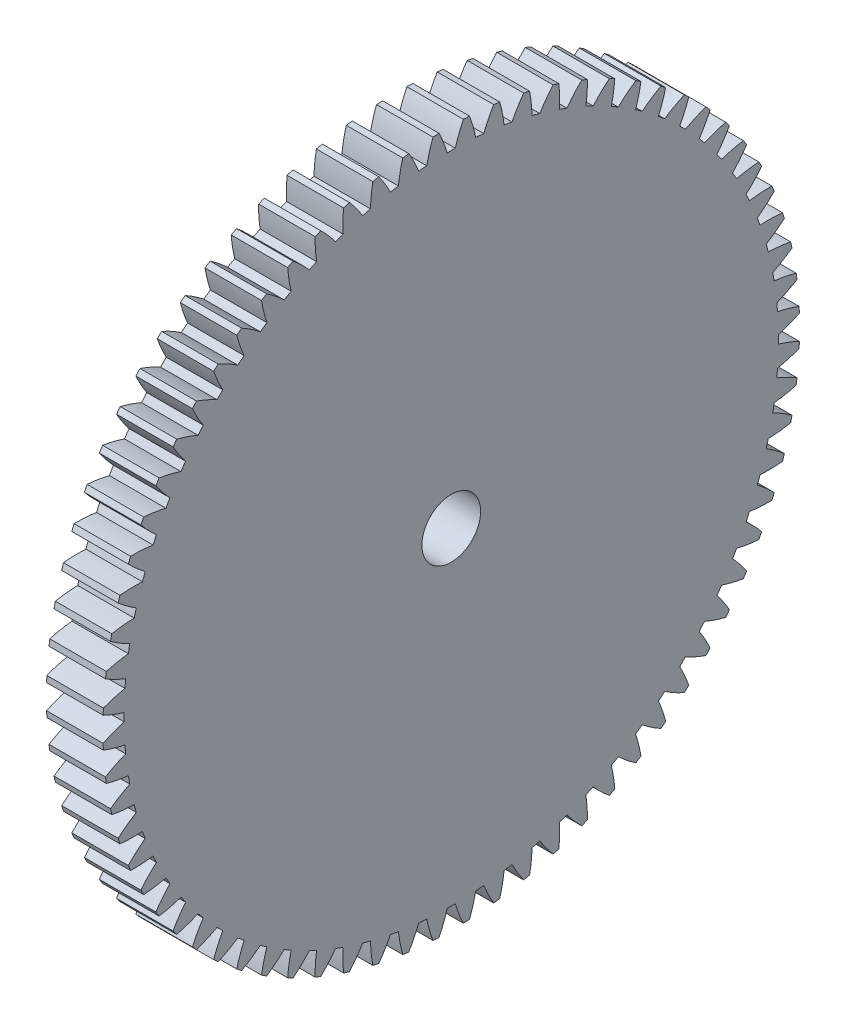
from build123d import *

# Parameters (mm, degrees)
SKETCH1_W          = 6.35
SKETCH1_H          = 39.158333333
CUT_EXTRUDE1_DEPTH = 56.741121615
SKETCH5_R          = 3.302
CUT_EXTRUDE3_DEPTH = 56.70763123


with BuildPart() as part:
    # Sketch1 → Revolve1 (revolve)
    with BuildSketch(Plane.XY, mode=Mode.PRIVATE) as revolve1_sk:
        with Locations((3.175, 19.579166667)):
            Rectangle(SKETCH1_W, SKETCH1_H)
    revolve(revolve1_sk.sketch.rotate(Axis((-10, 0, 0), (1, 0, 0)), 90), axis=Axis((-10, 0, 0), (1, 0, 0)))

    # Sketch2 → Cut-Extrude1 (cut, through all)
    with BuildSketch(Plane.ZY):
        with BuildLine():
            ThreePointArc((0.453579929, 36.776403004), (0, 36.7792), (-0.453579929, 36.776403004))
            ThreePointArc((-0.453579929, 36.776403004), (-0.86587275, 37.987365832), (-1.378270139, 39.159485816))
            ThreePointArc((-1.378270139, 39.159485816), (0, 39.183733333), (1.378270139, 39.159485816))
            ThreePointArc((1.378270139, 39.159485816), (0.86587275, 37.987365832), (0.453579929, 36.776403004))
        make_face()
        with BuildLine():
            ThreePointArc((2.753420799, 36.675989783), (2.448239242, 37.918278219), (2.039948667, 39.130596307))
            ThreePointArc((2.039948667, 39.130596307), (3.415087382, 39.034627398), (4.785999477, 38.890347992))
            ThreePointArc((4.785999477, 38.890347992), (4.173394926, 37.767346654), (3.65712864, 36.596925592))
            ThreePointArc((3.65712864, 36.596925592), (3.205518494, 36.63924404), (2.753420799, 36.675989783))
        make_face()
        with BuildLine():
            ThreePointArc((5.939466332, 36.296450134), (5.743718654, 37.560609613), (5.442642232, 38.803899333))
            ThreePointArc((5.442642232, 38.803899333), (6.804183888, 38.588444379), (8.157304469, 38.325231137))
            ThreePointArc((8.157304469, 38.325231137), (7.449155048, 37.259895163), (6.832844394, 36.138923478))
            ThreePointArc((6.832844394, 36.138923478), (6.386641056, 36.22044131), (5.939466332, 36.296450134))
        make_face()
        with BuildLine():
            ThreePointArc((9.08030894, 35.640672583), (8.9954849, 36.917082088), (8.803914003, 38.181881255))
            ThreePointArc((8.803914003, 38.181881255), (10.141496445, 37.848579997), (11.466527448, 37.468436132))
            ThreePointArc((11.466527448, 37.468436132), (10.668222602, 36.468873372), (9.956558076, 35.405882335))
            ThreePointArc((9.956558076, 35.405882335), (9.519157424, 35.52597915), (9.08030894, 35.640672583))
        make_face()
        with BuildLine():
            ThreePointArc((12.152044914, 34.713647994), (12.178790073, 35.992593277), (12.098182672, 37.269276005))
            ThreePointArc((12.098182672, 37.269276005), (13.401626091, 36.820665068), (14.68848323, 36.326483704))
            ThreePointArc((14.68848323, 36.326483704), (13.80609854, 35.400301434), (13.004496339, 34.403381049))
            ThreePointArc((13.004496339, 34.403381049), (12.579227255, 34.561142838), (12.152044914, 34.713647994))
        make_face()
        with BuildLine():
            ThreePointArc((15.131296489, 33.522431583), (15.269407301, 34.794179099), (15.300376867, 36.073029062))
            ThreePointArc((15.300376867, 36.073029062), (16.55976127, 35.512522645), (17.798650786, 34.908064801))
            ThreePointArc((17.798650786, 34.908064801), (16.838901731, 34.062311826), (15.953462532, 33.13904926))
            ThreePointArc((15.953462532, 33.13904926), (15.543561572, 33.333275361), (15.131296489, 33.522431583))
        make_face()
        with BuildLine():
            ThreePointArc((17.99538976, 32.076089226), (18.243815118, 33.330960208), (18.386125954, 34.602244585))
            ThreePointArc((18.386125954, 34.602244585), (19.591866667, 33.934108482), (20.773359862, 33.223974446))
            ThreePointArc((20.773359862, 33.223974446), (19.743550714, 32.465087459), (18.781013243, 31.622509296))
            ThreePointArc((18.781013243, 31.622509296), (18.3896, 31.851721531), (17.99538976, 32.076089226))
        make_face()
        with BuildLine():
            ThreePointArc((20.72252725, 30.385628461), (21.079376487, 31.614072584), (21.331945522, 32.868116134))
            ThreePointArc((21.331945522, 32.868116134), (22.474866128, 32.097435263), (23.589971126, 31.287029585))
            ThreePointArc((23.589971126, 31.287029585), (22.497939353, 30.620784172), (21.465629103, 29.865302943))
            ThreePointArc((21.465629103, 29.865302943), (21.095682468, 30.127756867), (20.72252725, 30.385628461))
        make_face()
        with BuildLine():
            ThreePointArc((23.291953795, 28.463914717), (23.754511073, 29.656582779), (24.115416103, 30.883841473))
            ThreePointArc((24.115416103, 30.883841473), (25.186818288, 30.016481181), (26.227048465, 29.111971536))
            ThreePointArc((26.227048465, 29.111971536), (25.08110509, 28.543438229), (23.986878564, 27.8808036))
            ThreePointArc((23.986878564, 27.8808036), (23.641214054, 28.174501782), (23.291953795, 28.463914717))
        make_face()
        with BuildLine():
            ThreePointArc((25.684114508, 26.325573395), (26.248859486, 27.473388472), (26.715353807, 28.66452213))
            ThreePointArc((26.715353807, 28.66452213), (27.707083552, 27.707083552), (28.66452213, 26.715353807))
            ThreePointArc((28.66452213, 26.715353807), (27.473388472, 26.248859486), (26.325573395, 25.684114508))
            ThreePointArc((26.325573395, 25.684114508), (26.006821727, 26.006821727), (25.684114508, 26.325573395))
        make_face()
        with BuildLine():
            ThreePointArc((27.8808036, 23.986878564), (28.543438229, 25.08110509), (29.111971536, 26.227048465))
            ThreePointArc((29.111971536, 26.227048465), (30.016481181, 25.186818288), (30.883841473, 24.115416103))
            ThreePointArc((30.883841473, 24.115416103), (29.656582779, 23.754511073), (28.463914717, 23.291953795))
            ThreePointArc((28.463914717, 23.291953795), (28.174501782, 23.641214054), (27.8808036, 23.986878564))
        make_face()
        with BuildLine():
            ThreePointArc((29.865302943, 21.465629103), (30.620784172, 22.497939353), (31.287029585, 23.589971126))
            ThreePointArc((31.287029585, 23.589971126), (32.097435263, 22.474866128), (32.868116134, 21.331945522))
            ThreePointArc((32.868116134, 21.331945522), (31.614072584, 21.079376487), (30.385628461, 20.72252725))
            ThreePointArc((30.385628461, 20.72252725), (30.127756867, 21.095682468), (29.865302943, 21.465629103))
        make_face()
        with BuildLine():
            ThreePointArc((31.622509296, 18.781013243), (32.465087459, 19.743550714), (33.223974446, 20.773359862))
            ThreePointArc((33.223974446, 20.773359862), (33.934108482, 19.591866667), (34.602244585, 18.386125954))
            ThreePointArc((34.602244585, 18.386125954), (33.330960208, 18.243815118), (32.076089226, 17.99538976))
            ThreePointArc((32.076089226, 17.99538976), (31.851721531, 18.3896), (31.622509296, 18.781013243))
        make_face()
        with BuildLine():
            ThreePointArc((33.13904926, 15.953462532), (34.062311826, 16.838901731), (34.908064801, 17.798650786))
            ThreePointArc((34.908064801, 17.798650786), (35.512522645, 16.55976127), (36.073029062, 15.300376867))
            ThreePointArc((36.073029062, 15.300376867), (34.794179099, 15.269407301), (33.522431583, 15.131296489))
            ThreePointArc((33.522431583, 15.131296489), (33.333275361, 15.543561572), (33.13904926, 15.953462532))
        make_face()
        with BuildLine():
            ThreePointArc((34.403381049, 13.004496339), (35.400301434, 13.80609854), (36.326483704, 14.68848323))
            ThreePointArc((36.326483704, 14.68848323), (36.820665068, 13.401626091), (37.269276005, 12.098182672))
            ThreePointArc((37.269276005, 12.098182672), (35.992593277, 12.178790073), (34.713647994, 12.152044914))
            ThreePointArc((34.713647994, 12.152044914), (34.561142838, 12.579227255), (34.403381049, 13.004496339))
        make_face()
        with BuildLine():
            ThreePointArc((35.405882335, 9.956558076), (36.468873372, 10.668222602), (37.468436132, 11.466527448))
            ThreePointArc((37.468436132, 11.466527448), (37.848579997, 10.141496445), (38.181881255, 8.803914003))
            ThreePointArc((38.181881255, 8.803914003), (36.917082088, 8.9954849), (35.640672583, 9.08030894))
            ThreePointArc((35.640672583, 9.08030894), (35.52597915, 9.519157424), (35.405882335, 9.956558076))
        make_face()
        with BuildLine():
            ThreePointArc((36.138923478, 6.832844394), (37.259895163, 7.449155048), (38.325231137, 8.157304469))
            ThreePointArc((38.325231137, 8.157304469), (38.588444379, 6.804183888), (38.803899333, 5.442642232))
            ThreePointArc((38.803899333, 5.442642232), (37.560609613, 5.743718654), (36.296450134, 5.939466332))
            ThreePointArc((36.296450134, 5.939466332), (36.22044131, 6.386641056), (36.138923478, 6.832844394))
        make_face()
        with BuildLine():
            ThreePointArc((36.596925592, 3.65712864), (37.767346654, 4.173394926), (38.890347992, 4.785999477))
            ThreePointArc((38.890347992, 4.785999477), (39.034627398, 3.415087382), (39.130596307, 2.039948667))
            ThreePointArc((39.130596307, 2.039948667), (37.918278219, 2.448239242), (36.675989783, 2.753420799))
            ThreePointArc((36.675989783, 2.753420799), (36.63924404, 3.205518494), (36.596925592, 3.65712864))
        make_face()
        with BuildLine():
            ThreePointArc((36.776403004, 0.453579929), (37.987365832, 0.86587275), (39.159485816, 1.378270139))
            ThreePointArc((39.159485816, 1.378270139), (39.183733333, 0), (39.159485816, -1.378270139))
            ThreePointArc((39.159485816, -1.378270139), (37.987365832, -0.86587275), (36.776403004, -0.453579929))
            ThreePointArc((36.776403004, -0.453579929), (36.7792, 0), (36.776403004, 0.453579929))
        make_face()
        with BuildLine():
            ThreePointArc((36.675989783, -2.753420799), (37.918278219, -2.448239242), (39.130596307, -2.039948667))
            ThreePointArc((39.130596307, -2.039948667), (39.034627398, -3.415087382), (38.890347992, -4.785999477))
            ThreePointArc((38.890347992, -4.785999477), (37.767346654, -4.173394926), (36.596925592, -3.65712864))
            ThreePointArc((36.596925592, -3.65712864), (36.63924404, -3.205518494), (36.675989783, -2.753420799))
        make_face()
        with BuildLine():
            ThreePointArc((36.296450134, -5.939466332), (37.560609613, -5.743718654), (38.803899333, -5.442642232))
            ThreePointArc((38.803899333, -5.442642232), (38.588444379, -6.804183888), (38.325231137, -8.157304469))
            ThreePointArc((38.325231137, -8.157304469), (37.259895163, -7.449155048), (36.138923478, -6.832844394))
            ThreePointArc((36.138923478, -6.832844394), (36.22044131, -6.386641056), (36.296450134, -5.939466332))
        make_face()
        with BuildLine():
            ThreePointArc((35.640672583, -9.08030894), (36.917082088, -8.9954849), (38.181881255, -8.803914003))
            ThreePointArc((38.181881255, -8.803914003), (37.848579997, -10.141496445), (37.468436132, -11.466527448))
            ThreePointArc((37.468436132, -11.466527448), (36.468873372, -10.668222602), (35.405882335, -9.956558076))
            ThreePointArc((35.405882335, -9.956558076), (35.52597915, -9.519157424), (35.640672583, -9.08030894))
        make_face()
        with BuildLine():
            ThreePointArc((34.713647994, -12.152044914), (35.992593277, -12.178790073), (37.269276005, -12.098182672))
            ThreePointArc((37.269276005, -12.098182672), (36.820665068, -13.401626091), (36.326483704, -14.68848323))
            ThreePointArc((36.326483704, -14.68848323), (35.400301434, -13.80609854), (34.403381049, -13.004496339))
            ThreePointArc((34.403381049, -13.004496339), (34.561142838, -12.579227255), (34.713647994, -12.152044914))
        make_face()
        with BuildLine():
            ThreePointArc((33.522431583, -15.131296489), (34.794179099, -15.269407301), (36.073029062, -15.300376867))
            ThreePointArc((36.073029062, -15.300376867), (35.512522645, -16.55976127), (34.908064801, -17.798650786))
            ThreePointArc((34.908064801, -17.798650786), (34.062311826, -16.838901731), (33.13904926, -15.953462532))
            ThreePointArc((33.13904926, -15.953462532), (33.333275361, -15.543561572), (33.522431583, -15.131296489))
        make_face()
        with BuildLine():
            ThreePointArc((32.076089226, -17.99538976), (33.330960208, -18.243815118), (34.602244585, -18.386125954))
            ThreePointArc((34.602244585, -18.386125954), (33.934108482, -19.591866667), (33.223974446, -20.773359862))
            ThreePointArc((33.223974446, -20.773359862), (32.465087459, -19.743550714), (31.622509296, -18.781013243))
            ThreePointArc((31.622509296, -18.781013243), (31.851721531, -18.3896), (32.076089226, -17.99538976))
        make_face()
        with BuildLine():
            ThreePointArc((30.385628461, -20.72252725), (31.614072584, -21.079376487), (32.868116134, -21.331945522))
            ThreePointArc((32.868116134, -21.331945522), (32.097435263, -22.474866128), (31.287029585, -23.589971126))
            ThreePointArc((31.287029585, -23.589971126), (30.620784172, -22.497939353), (29.865302943, -21.465629103))
            ThreePointArc((29.865302943, -21.465629103), (30.127756867, -21.095682468), (30.385628461, -20.72252725))
        make_face()
        with BuildLine():
            ThreePointArc((28.463914717, -23.291953795), (29.656582779, -23.754511073), (30.883841473, -24.115416103))
            ThreePointArc((30.883841473, -24.115416103), (30.016481181, -25.186818288), (29.111971536, -26.227048465))
            ThreePointArc((29.111971536, -26.227048465), (28.543438229, -25.08110509), (27.8808036, -23.986878564))
            ThreePointArc((27.8808036, -23.986878564), (28.174501782, -23.641214054), (28.463914717, -23.291953795))
        make_face()
        with BuildLine():
            ThreePointArc((26.325573395, -25.684114508), (27.473388472, -26.248859486), (28.66452213, -26.715353807))
            ThreePointArc((28.66452213, -26.715353807), (27.707083552, -27.707083552), (26.715353807, -28.66452213))
            ThreePointArc((26.715353807, -28.66452213), (26.248859486, -27.473388472), (25.684114508, -26.325573395))
            ThreePointArc((25.684114508, -26.325573395), (26.006821727, -26.006821727), (26.325573395, -25.684114508))
        make_face()
        with BuildLine():
            ThreePointArc((23.986878564, -27.8808036), (25.08110509, -28.543438229), (26.227048465, -29.111971536))
            ThreePointArc((26.227048465, -29.111971536), (25.186818288, -30.016481181), (24.115416103, -30.883841473))
            ThreePointArc((24.115416103, -30.883841473), (23.754511073, -29.656582779), (23.291953795, -28.463914717))
            ThreePointArc((23.291953795, -28.463914717), (23.641214054, -28.174501782), (23.986878564, -27.8808036))
        make_face()
        with BuildLine():
            ThreePointArc((21.465629103, -29.865302943), (22.497939353, -30.620784172), (23.589971126, -31.287029585))
            ThreePointArc((23.589971126, -31.287029585), (22.474866128, -32.097435263), (21.331945522, -32.868116134))
            ThreePointArc((21.331945522, -32.868116134), (21.079376487, -31.614072584), (20.72252725, -30.385628461))
            ThreePointArc((20.72252725, -30.385628461), (21.095682468, -30.127756867), (21.465629103, -29.865302943))
        make_face()
        with BuildLine():
            ThreePointArc((18.781013243, -31.622509296), (19.743550714, -32.465087459), (20.773359862, -33.223974446))
            ThreePointArc((20.773359862, -33.223974446), (19.591866667, -33.934108482), (18.386125954, -34.602244585))
            ThreePointArc((18.386125954, -34.602244585), (18.243815118, -33.330960208), (17.99538976, -32.076089226))
            ThreePointArc((17.99538976, -32.076089226), (18.3896, -31.851721531), (18.781013243, -31.622509296))
        make_face()
        with BuildLine():
            ThreePointArc((15.953462532, -33.13904926), (16.838901731, -34.062311826), (17.798650786, -34.908064801))
            ThreePointArc((17.798650786, -34.908064801), (16.55976127, -35.512522645), (15.300376867, -36.073029062))
            ThreePointArc((15.300376867, -36.073029062), (15.269407301, -34.794179099), (15.131296489, -33.522431583))
            ThreePointArc((15.131296489, -33.522431583), (15.543561572, -33.333275361), (15.953462532, -33.13904926))
        make_face()
        with BuildLine():
            ThreePointArc((13.004496339, -34.403381049), (13.80609854, -35.400301434), (14.68848323, -36.326483704))
            ThreePointArc((14.68848323, -36.326483704), (13.401626091, -36.820665068), (12.098182672, -37.269276005))
            ThreePointArc((12.098182672, -37.269276005), (12.178790073, -35.992593277), (12.152044914, -34.713647994))
            ThreePointArc((12.152044914, -34.713647994), (12.579227255, -34.561142838), (13.004496339, -34.403381049))
        make_face()
        with BuildLine():
            ThreePointArc((9.956558076, -35.405882335), (10.668222602, -36.468873372), (11.466527448, -37.468436132))
            ThreePointArc((11.466527448, -37.468436132), (10.141496445, -37.848579997), (8.803914003, -38.181881255))
            ThreePointArc((8.803914003, -38.181881255), (8.9954849, -36.917082088), (9.08030894, -35.640672583))
            ThreePointArc((9.08030894, -35.640672583), (9.519157424, -35.52597915), (9.956558076, -35.405882335))
        make_face()
        with BuildLine():
            ThreePointArc((6.832844394, -36.138923478), (7.449155048, -37.259895163), (8.157304469, -38.325231137))
            ThreePointArc((8.157304469, -38.325231137), (6.804183888, -38.588444379), (5.442642232, -38.803899333))
            ThreePointArc((5.442642232, -38.803899333), (5.743718654, -37.560609613), (5.939466332, -36.296450134))
            ThreePointArc((5.939466332, -36.296450134), (6.386641056, -36.22044131), (6.832844394, -36.138923478))
        make_face()
        with BuildLine():
            ThreePointArc((3.65712864, -36.596925592), (4.173394926, -37.767346654), (4.785999477, -38.890347992))
            ThreePointArc((4.785999477, -38.890347992), (3.415087382, -39.034627398), (2.039948667, -39.130596307))
            ThreePointArc((2.039948667, -39.130596307), (2.448239242, -37.918278219), (2.753420799, -36.675989783))
            ThreePointArc((2.753420799, -36.675989783), (3.205518494, -36.63924404), (3.65712864, -36.596925592))
        make_face()
        with BuildLine():
            ThreePointArc((0.453579929, -36.776403004), (0.86587275, -37.987365832), (1.378270139, -39.159485816))
            ThreePointArc((1.378270139, -39.159485816), (0, -39.183733333), (-1.378270139, -39.159485816))
            ThreePointArc((-1.378270139, -39.159485816), (-0.86587275, -37.987365832), (-0.453579929, -36.776403004))
            ThreePointArc((-0.453579929, -36.776403004), (0, -36.7792), (0.453579929, -36.776403004))
        make_face()
        with BuildLine():
            ThreePointArc((-2.753420799, -36.675989783), (-2.448239242, -37.918278219), (-2.039948667, -39.130596307))
            ThreePointArc((-2.039948667, -39.130596307), (-3.415087382, -39.034627398), (-4.785999477, -38.890347992))
            ThreePointArc((-4.785999477, -38.890347992), (-4.173394926, -37.767346654), (-3.65712864, -36.596925592))
            ThreePointArc((-3.65712864, -36.596925592), (-3.205518494, -36.63924404), (-2.753420799, -36.675989783))
        make_face()
        with BuildLine():
            ThreePointArc((-5.939466332, -36.296450134), (-5.743718654, -37.560609613), (-5.442642232, -38.803899333))
            ThreePointArc((-5.442642232, -38.803899333), (-6.804183888, -38.588444379), (-8.157304469, -38.325231137))
            ThreePointArc((-8.157304469, -38.325231137), (-7.449155048, -37.259895163), (-6.832844394, -36.138923478))
            ThreePointArc((-6.832844394, -36.138923478), (-6.386641056, -36.22044131), (-5.939466332, -36.296450134))
        make_face()
        with BuildLine():
            ThreePointArc((-9.08030894, -35.640672583), (-8.9954849, -36.917082088), (-8.803914003, -38.181881255))
            ThreePointArc((-8.803914003, -38.181881255), (-10.141496445, -37.848579997), (-11.466527448, -37.468436132))
            ThreePointArc((-11.466527448, -37.468436132), (-10.668222602, -36.468873372), (-9.956558076, -35.405882335))
            ThreePointArc((-9.956558076, -35.405882335), (-9.519157424, -35.52597915), (-9.08030894, -35.640672583))
        make_face()
        with BuildLine():
            ThreePointArc((-12.152044914, -34.713647994), (-12.178790073, -35.992593277), (-12.098182672, -37.269276005))
            ThreePointArc((-12.098182672, -37.269276005), (-13.401626091, -36.820665068), (-14.68848323, -36.326483704))
            ThreePointArc((-14.68848323, -36.326483704), (-13.80609854, -35.400301434), (-13.004496339, -34.403381049))
            ThreePointArc((-13.004496339, -34.403381049), (-12.579227255, -34.561142838), (-12.152044914, -34.713647994))
        make_face()
        with BuildLine():
            ThreePointArc((-15.131296489, -33.522431583), (-15.269407301, -34.794179099), (-15.300376867, -36.073029062))
            ThreePointArc((-15.300376867, -36.073029062), (-16.55976127, -35.512522645), (-17.798650786, -34.908064801))
            ThreePointArc((-17.798650786, -34.908064801), (-16.838901731, -34.062311826), (-15.953462532, -33.13904926))
            ThreePointArc((-15.953462532, -33.13904926), (-15.543561572, -33.333275361), (-15.131296489, -33.522431583))
        make_face()
        with BuildLine():
            ThreePointArc((-17.99538976, -32.076089226), (-18.243815118, -33.330960208), (-18.386125954, -34.602244585))
            ThreePointArc((-18.386125954, -34.602244585), (-19.591866667, -33.934108482), (-20.773359862, -33.223974446))
            ThreePointArc((-20.773359862, -33.223974446), (-19.743550714, -32.465087459), (-18.781013243, -31.622509296))
            ThreePointArc((-18.781013243, -31.622509296), (-18.3896, -31.851721531), (-17.99538976, -32.076089226))
        make_face()
        with BuildLine():
            ThreePointArc((-20.72252725, -30.385628461), (-21.079376487, -31.614072584), (-21.331945522, -32.868116134))
            ThreePointArc((-21.331945522, -32.868116134), (-22.474866128, -32.097435263), (-23.589971126, -31.287029585))
            ThreePointArc((-23.589971126, -31.287029585), (-22.497939353, -30.620784172), (-21.465629103, -29.865302943))
            ThreePointArc((-21.465629103, -29.865302943), (-21.095682468, -30.127756867), (-20.72252725, -30.385628461))
        make_face()
        with BuildLine():
            ThreePointArc((-23.291953795, -28.463914717), (-23.754511073, -29.656582779), (-24.115416103, -30.883841473))
            ThreePointArc((-24.115416103, -30.883841473), (-25.186818288, -30.016481181), (-26.227048465, -29.111971536))
            ThreePointArc((-26.227048465, -29.111971536), (-25.08110509, -28.543438229), (-23.986878564, -27.8808036))
            ThreePointArc((-23.986878564, -27.8808036), (-23.641214054, -28.174501782), (-23.291953795, -28.463914717))
        make_face()
        with BuildLine():
            ThreePointArc((-25.684114508, -26.325573395), (-26.248859486, -27.473388472), (-26.715353807, -28.66452213))
            ThreePointArc((-26.715353807, -28.66452213), (-27.707083552, -27.707083552), (-28.66452213, -26.715353807))
            ThreePointArc((-28.66452213, -26.715353807), (-27.473388472, -26.248859486), (-26.325573395, -25.684114508))
            ThreePointArc((-26.325573395, -25.684114508), (-26.006821727, -26.006821727), (-25.684114508, -26.325573395))
        make_face()
        with BuildLine():
            ThreePointArc((-27.8808036, -23.986878564), (-28.543438229, -25.08110509), (-29.111971536, -26.227048465))
            ThreePointArc((-29.111971536, -26.227048465), (-30.016481181, -25.186818288), (-30.883841473, -24.115416103))
            ThreePointArc((-30.883841473, -24.115416103), (-29.656582779, -23.754511073), (-28.463914717, -23.291953795))
            ThreePointArc((-28.463914717, -23.291953795), (-28.174501782, -23.641214054), (-27.8808036, -23.986878564))
        make_face()
        with BuildLine():
            ThreePointArc((-29.865302943, -21.465629103), (-30.620784172, -22.497939353), (-31.287029585, -23.589971126))
            ThreePointArc((-31.287029585, -23.589971126), (-32.097435263, -22.474866128), (-32.868116134, -21.331945522))
            ThreePointArc((-32.868116134, -21.331945522), (-31.614072584, -21.079376487), (-30.385628461, -20.72252725))
            ThreePointArc((-30.385628461, -20.72252725), (-30.127756867, -21.095682468), (-29.865302943, -21.465629103))
        make_face()
        with BuildLine():
            ThreePointArc((-31.622509296, -18.781013243), (-32.465087459, -19.743550714), (-33.223974446, -20.773359862))
            ThreePointArc((-33.223974446, -20.773359862), (-33.934108482, -19.591866667), (-34.602244585, -18.386125954))
            ThreePointArc((-34.602244585, -18.386125954), (-33.330960208, -18.243815118), (-32.076089226, -17.99538976))
            ThreePointArc((-32.076089226, -17.99538976), (-31.851721531, -18.3896), (-31.622509296, -18.781013243))
        make_face()
        with BuildLine():
            ThreePointArc((-33.13904926, -15.953462532), (-34.062311826, -16.838901731), (-34.908064801, -17.798650786))
            ThreePointArc((-34.908064801, -17.798650786), (-35.512522645, -16.55976127), (-36.073029062, -15.300376867))
            ThreePointArc((-36.073029062, -15.300376867), (-34.794179099, -15.269407301), (-33.522431583, -15.131296489))
            ThreePointArc((-33.522431583, -15.131296489), (-33.333275361, -15.543561572), (-33.13904926, -15.953462532))
        make_face()
        with BuildLine():
            ThreePointArc((-34.403381049, -13.004496339), (-35.400301434, -13.80609854), (-36.326483704, -14.68848323))
            ThreePointArc((-36.326483704, -14.68848323), (-36.820665068, -13.401626091), (-37.269276005, -12.098182672))
            ThreePointArc((-37.269276005, -12.098182672), (-35.992593277, -12.178790073), (-34.713647994, -12.152044914))
            ThreePointArc((-34.713647994, -12.152044914), (-34.561142838, -12.579227255), (-34.403381049, -13.004496339))
        make_face()
        with BuildLine():
            ThreePointArc((-35.405882335, -9.956558076), (-36.468873372, -10.668222602), (-37.468436132, -11.466527448))
            ThreePointArc((-37.468436132, -11.466527448), (-37.848579997, -10.141496445), (-38.181881255, -8.803914003))
            ThreePointArc((-38.181881255, -8.803914003), (-36.917082088, -8.9954849), (-35.640672583, -9.08030894))
            ThreePointArc((-35.640672583, -9.08030894), (-35.52597915, -9.519157424), (-35.405882335, -9.956558076))
        make_face()
        with BuildLine():
            ThreePointArc((-36.138923478, -6.832844394), (-37.259895163, -7.449155048), (-38.325231137, -8.157304469))
            ThreePointArc((-38.325231137, -8.157304469), (-38.588444379, -6.804183888), (-38.803899333, -5.442642232))
            ThreePointArc((-38.803899333, -5.442642232), (-37.560609613, -5.743718654), (-36.296450134, -5.939466332))
            ThreePointArc((-36.296450134, -5.939466332), (-36.22044131, -6.386641056), (-36.138923478, -6.832844394))
        make_face()
        with BuildLine():
            ThreePointArc((-36.596925592, -3.65712864), (-37.767346654, -4.173394926), (-38.890347992, -4.785999477))
            ThreePointArc((-38.890347992, -4.785999477), (-39.034627398, -3.415087382), (-39.130596307, -2.039948667))
            ThreePointArc((-39.130596307, -2.039948667), (-37.918278219, -2.448239242), (-36.675989783, -2.753420799))
            ThreePointArc((-36.675989783, -2.753420799), (-36.63924404, -3.205518494), (-36.596925592, -3.65712864))
        make_face()
        with BuildLine():
            ThreePointArc((-36.776403004, -0.453579929), (-37.987365832, -0.86587275), (-39.159485816, -1.378270139))
            ThreePointArc((-39.159485816, -1.378270139), (-39.183733333, 0), (-39.159485816, 1.378270139))
            ThreePointArc((-39.159485816, 1.378270139), (-37.987365832, 0.86587275), (-36.776403004, 0.453579929))
            ThreePointArc((-36.776403004, 0.453579929), (-36.7792, 0), (-36.776403004, -0.453579929))
        make_face()
        with BuildLine():
            ThreePointArc((-36.675989783, 2.753420799), (-37.918278219, 2.448239242), (-39.130596307, 2.039948667))
            ThreePointArc((-39.130596307, 2.039948667), (-39.034627398, 3.415087382), (-38.890347992, 4.785999477))
            ThreePointArc((-38.890347992, 4.785999477), (-37.767346654, 4.173394926), (-36.596925592, 3.65712864))
            ThreePointArc((-36.596925592, 3.65712864), (-36.63924404, 3.205518494), (-36.675989783, 2.753420799))
        make_face()
        with BuildLine():
            ThreePointArc((-36.296450134, 5.939466332), (-37.560609613, 5.743718654), (-38.803899333, 5.442642232))
            ThreePointArc((-38.803899333, 5.442642232), (-38.588444379, 6.804183888), (-38.325231137, 8.157304469))
            ThreePointArc((-38.325231137, 8.157304469), (-37.259895163, 7.449155048), (-36.138923478, 6.832844394))
            ThreePointArc((-36.138923478, 6.832844394), (-36.22044131, 6.386641056), (-36.296450134, 5.939466332))
        make_face()
        with BuildLine():
            ThreePointArc((-35.640672583, 9.08030894), (-36.917082088, 8.9954849), (-38.181881255, 8.803914003))
            ThreePointArc((-38.181881255, 8.803914003), (-37.848579997, 10.141496445), (-37.468436132, 11.466527448))
            ThreePointArc((-37.468436132, 11.466527448), (-36.468873372, 10.668222602), (-35.405882335, 9.956558076))
            ThreePointArc((-35.405882335, 9.956558076), (-35.52597915, 9.519157424), (-35.640672583, 9.08030894))
        make_face()
        with BuildLine():
            ThreePointArc((-34.713647994, 12.152044914), (-35.992593277, 12.178790073), (-37.269276005, 12.098182672))
            ThreePointArc((-37.269276005, 12.098182672), (-36.820665068, 13.401626091), (-36.326483704, 14.68848323))
            ThreePointArc((-36.326483704, 14.68848323), (-35.400301434, 13.80609854), (-34.403381049, 13.004496339))
            ThreePointArc((-34.403381049, 13.004496339), (-34.561142838, 12.579227255), (-34.713647994, 12.152044914))
        make_face()
        with BuildLine():
            ThreePointArc((-33.522431583, 15.131296489), (-34.794179099, 15.269407301), (-36.073029062, 15.300376867))
            ThreePointArc((-36.073029062, 15.300376867), (-35.512522645, 16.55976127), (-34.908064801, 17.798650786))
            ThreePointArc((-34.908064801, 17.798650786), (-34.062311826, 16.838901731), (-33.13904926, 15.953462532))
            ThreePointArc((-33.13904926, 15.953462532), (-33.333275361, 15.543561572), (-33.522431583, 15.131296489))
        make_face()
        with BuildLine():
            ThreePointArc((-32.076089226, 17.99538976), (-33.330960208, 18.243815118), (-34.602244585, 18.386125954))
            ThreePointArc((-34.602244585, 18.386125954), (-33.934108482, 19.591866667), (-33.223974446, 20.773359862))
            ThreePointArc((-33.223974446, 20.773359862), (-32.465087459, 19.743550714), (-31.622509296, 18.781013243))
            ThreePointArc((-31.622509296, 18.781013243), (-31.851721531, 18.3896), (-32.076089226, 17.99538976))
        make_face()
        with BuildLine():
            ThreePointArc((-30.385628461, 20.72252725), (-31.614072584, 21.079376487), (-32.868116134, 21.331945522))
            ThreePointArc((-32.868116134, 21.331945522), (-32.097435263, 22.474866128), (-31.287029585, 23.589971126))
            ThreePointArc((-31.287029585, 23.589971126), (-30.620784172, 22.497939353), (-29.865302943, 21.465629103))
            ThreePointArc((-29.865302943, 21.465629103), (-30.127756867, 21.095682468), (-30.385628461, 20.72252725))
        make_face()
        with BuildLine():
            ThreePointArc((-28.463914717, 23.291953795), (-29.656582779, 23.754511073), (-30.883841473, 24.115416103))
            ThreePointArc((-30.883841473, 24.115416103), (-30.016481181, 25.186818288), (-29.111971536, 26.227048465))
            ThreePointArc((-29.111971536, 26.227048465), (-28.543438229, 25.08110509), (-27.8808036, 23.986878564))
            ThreePointArc((-27.8808036, 23.986878564), (-28.174501782, 23.641214054), (-28.463914717, 23.291953795))
        make_face()
        with BuildLine():
            ThreePointArc((-26.325573395, 25.684114508), (-27.473388472, 26.248859486), (-28.66452213, 26.715353807))
            ThreePointArc((-28.66452213, 26.715353807), (-27.707083552, 27.707083552), (-26.715353807, 28.66452213))
            ThreePointArc((-26.715353807, 28.66452213), (-26.248859486, 27.473388472), (-25.684114508, 26.325573395))
            ThreePointArc((-25.684114508, 26.325573395), (-26.006821727, 26.006821727), (-26.325573395, 25.684114508))
        make_face()
        with BuildLine():
            ThreePointArc((-23.986878564, 27.8808036), (-25.08110509, 28.543438229), (-26.227048465, 29.111971536))
            ThreePointArc((-26.227048465, 29.111971536), (-25.186818288, 30.016481181), (-24.115416103, 30.883841473))
            ThreePointArc((-24.115416103, 30.883841473), (-23.754511073, 29.656582779), (-23.291953795, 28.463914717))
            ThreePointArc((-23.291953795, 28.463914717), (-23.641214054, 28.174501782), (-23.986878564, 27.8808036))
        make_face()
        with BuildLine():
            ThreePointArc((-21.465629103, 29.865302943), (-22.497939353, 30.620784172), (-23.589971126, 31.287029585))
            ThreePointArc((-23.589971126, 31.287029585), (-22.474866128, 32.097435263), (-21.331945522, 32.868116134))
            ThreePointArc((-21.331945522, 32.868116134), (-21.079376487, 31.614072584), (-20.72252725, 30.385628461))
            ThreePointArc((-20.72252725, 30.385628461), (-21.095682468, 30.127756867), (-21.465629103, 29.865302943))
        make_face()
        with BuildLine():
            ThreePointArc((-18.781013243, 31.622509296), (-19.743550714, 32.465087459), (-20.773359862, 33.223974446))
            ThreePointArc((-20.773359862, 33.223974446), (-19.591866667, 33.934108482), (-18.386125954, 34.602244585))
            ThreePointArc((-18.386125954, 34.602244585), (-18.243815118, 33.330960208), (-17.99538976, 32.076089226))
            ThreePointArc((-17.99538976, 32.076089226), (-18.3896, 31.851721531), (-18.781013243, 31.622509296))
        make_face()
        with BuildLine():
            ThreePointArc((-15.953462532, 33.13904926), (-16.838901731, 34.062311826), (-17.798650786, 34.908064801))
            ThreePointArc((-17.798650786, 34.908064801), (-16.55976127, 35.512522645), (-15.300376867, 36.073029062))
            ThreePointArc((-15.300376867, 36.073029062), (-15.269407301, 34.794179099), (-15.131296489, 33.522431583))
            ThreePointArc((-15.131296489, 33.522431583), (-15.543561572, 33.333275361), (-15.953462532, 33.13904926))
        make_face()
        with BuildLine():
            ThreePointArc((-13.004496339, 34.403381049), (-13.80609854, 35.400301434), (-14.68848323, 36.326483704))
            ThreePointArc((-14.68848323, 36.326483704), (-13.401626091, 36.820665068), (-12.098182672, 37.269276005))
            ThreePointArc((-12.098182672, 37.269276005), (-12.178790073, 35.992593277), (-12.152044914, 34.713647994))
            ThreePointArc((-12.152044914, 34.713647994), (-12.579227255, 34.561142838), (-13.004496339, 34.403381049))
        make_face()
        with BuildLine():
            ThreePointArc((-9.956558076, 35.405882335), (-10.668222602, 36.468873372), (-11.466527448, 37.468436132))
            ThreePointArc((-11.466527448, 37.468436132), (-10.141496445, 37.848579997), (-8.803914003, 38.181881255))
            ThreePointArc((-8.803914003, 38.181881255), (-8.9954849, 36.917082088), (-9.08030894, 35.640672583))
            ThreePointArc((-9.08030894, 35.640672583), (-9.519157424, 35.52597915), (-9.956558076, 35.405882335))
        make_face()
        with BuildLine():
            ThreePointArc((-6.832844394, 36.138923478), (-7.449155048, 37.259895163), (-8.157304469, 38.325231137))
            ThreePointArc((-8.157304469, 38.325231137), (-6.804183888, 38.588444379), (-5.442642232, 38.803899333))
            ThreePointArc((-5.442642232, 38.803899333), (-5.743718654, 37.560609613), (-5.939466332, 36.296450134))
            ThreePointArc((-5.939466332, 36.296450134), (-6.386641056, 36.22044131), (-6.832844394, 36.138923478))
        make_face()
        with BuildLine():
            ThreePointArc((-3.65712864, 36.596925592), (-4.173394926, 37.767346654), (-4.785999477, 38.890347992))
            ThreePointArc((-4.785999477, 38.890347992), (-3.415087382, 39.034627398), (-2.039948667, 39.130596307))
            ThreePointArc((-2.039948667, 39.130596307), (-2.448239242, 37.918278219), (-2.753420799, 36.675989783))
            ThreePointArc((-2.753420799, 36.675989783), (-3.205518494, 36.63924404), (-3.65712864, 36.596925592))
        make_face()
    extrude(amount=-CUT_EXTRUDE1_DEPTH, mode=Mode.SUBTRACT)

    # Sketch5 → Cut-Extrude3 (cut, through all)
    with BuildSketch(Plane.ZY):
        Circle(SKETCH5_R)
    extrude(amount=-CUT_EXTRUDE3_DEPTH, mode=Mode.SUBTRACT)


solid = part.part
